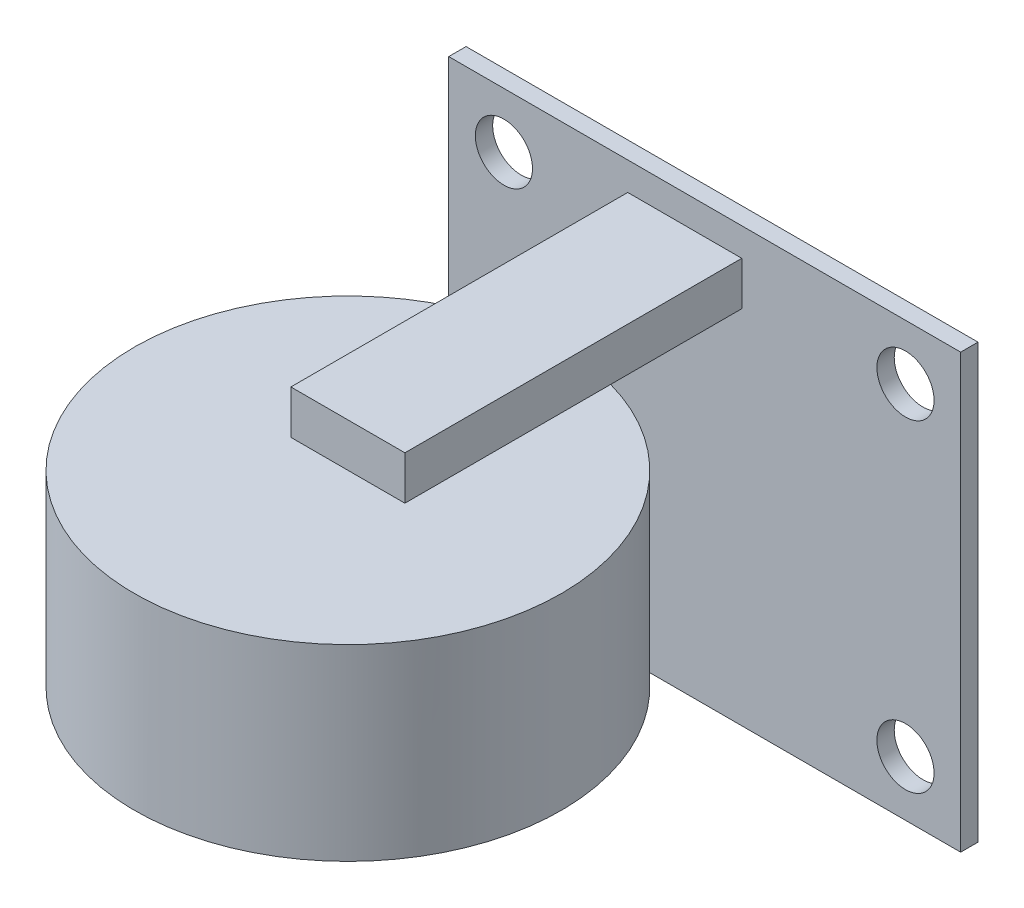
from build123d import *

# Parameters (mm, degrees)
SKETCH2_W           = 45.0088
SKETCH2_H           = 38.0746
SKETCH2_R           = 2.5146
BOSS_EXTRUDE1_DEPTH = 1.524
SKETCH3_W           = 10.026160074
SKETCH3_H           = 3.839196093
BOSS_EXTRUDE2_DEPTH = 29.6164
SKETCH4_R           = 18.7706
BOSS_EXTRUDE3_DEPTH = 16.51


with BuildPart() as part:
    # Sketch2 → Boss-Extrude1 (new body)
    with BuildSketch(Plane.XY):
        with Locations((22.5044, 19.0373)):
            Rectangle(SKETCH2_W, SKETCH2_H)
        with Locations(Location((4.8514, 33.2232, 0), (0, 0, 180))):
            Circle(SKETCH2_R, mode=Mode.SUBTRACT)
        with Locations(Location((4.8514, 4.8514, 0), (0, 0, 180))):
            Circle(SKETCH2_R, mode=Mode.SUBTRACT)
        with Locations(Location((40.1574, 4.8514, 0), (0, 0, 180))):
            Circle(SKETCH2_R, mode=Mode.SUBTRACT)
        with Locations(Location((40.1574, 33.2232, 0), (0, 0, 180))):
            Circle(SKETCH2_R, mode=Mode.SUBTRACT)
    extrude(amount=BOSS_EXTRUDE1_DEPTH)

    # Sketch3 → Boss-Extrude2 (add)
    with BuildSketch(Plane.XY.offset(1.524)):
        with Locations((20.750845866, 33.676355349)):
            Rectangle(SKETCH3_W, SKETCH3_H)
    extrude(amount=BOSS_EXTRUDE2_DEPTH)

    # Sketch4 → Boss-Extrude3 (add)
    with BuildSketch(Plane.XZ.offset(-31.756757303)):
        with Locations(Location((20.750845866, 31.1404, 0), (0, 0, 285.490039243))):
            Circle(SKETCH4_R)
    extrude(amount=BOSS_EXTRUDE3_DEPTH)


solid = part.part
